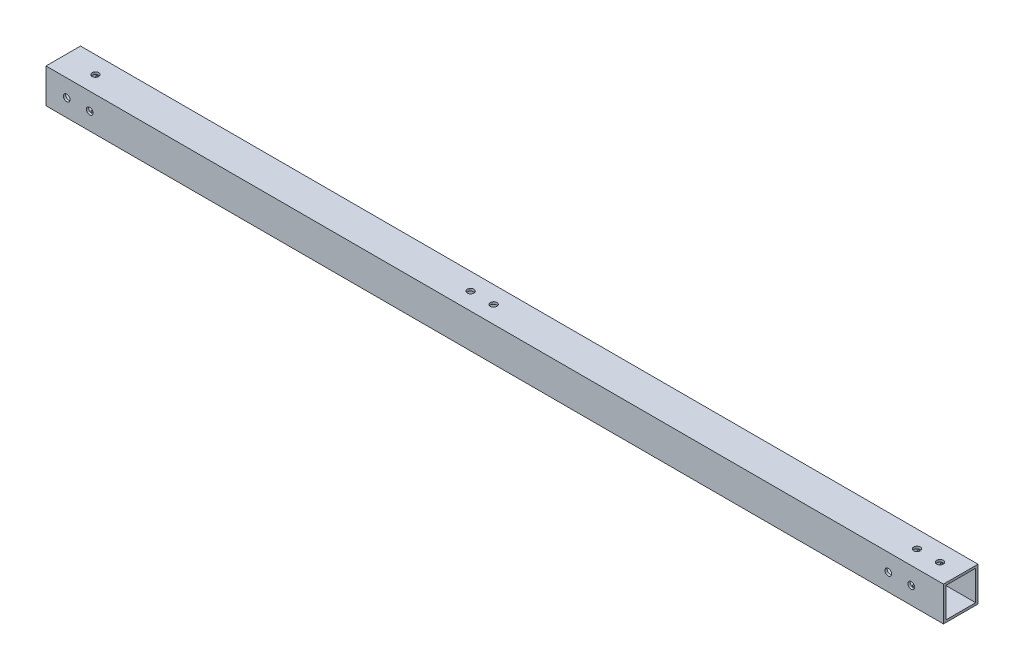
from build123d import *

# Parameters (mm, degrees)
SKETCH_1_W          = 15
SKETCH_1_H          = 15
SKETCH_1_W_2        = 13
SKETCH_1_H_2        = 13
EXTRUDE_1_DEPTH     = 390
SKETCH_2_R          = 1.45
CUT_EXTRUDE_1_DEPTH = 391.36041039
SKETCH_3_R          = 1.45
CUT_EXTRUDE_2_DEPTH = 391.36041039


with BuildPart() as part:
    # 草图1 → 凸台-拉伸1 (new body)
    with BuildSketch(Plane(origin=(0, 0, 0), x_dir=(0, 0, -1), z_dir=(1, 0, 0))):
        Rectangle(SKETCH_1_W, SKETCH_1_H)
        Rectangle(SKETCH_1_W_2, SKETCH_1_H_2, mode=Mode.SUBTRACT)
    extrude(amount=EXTRUDE_1_DEPTH)

    # 草图2 → 切除-拉伸1 (cut, through all)
    with BuildSketch(Plane(origin=(0, 0, -7.5), x_dir=(-1, 0, 0), z_dir=(0, 0, -1))):
        with Locations((-366, 0)):
            Circle(SKETCH_2_R)
        with Locations((-376, 0)):
            Circle(SKETCH_2_R)
        with Locations((-19, 0)):
            Circle(SKETCH_2_R)
        with Locations((-9, 0)):
            Circle(SKETCH_2_R)
    extrude(amount=-CUT_EXTRUDE_1_DEPTH, mode=Mode.SUBTRACT)

    # 草图3 → 切除-拉伸2 (cut, through all)
    with BuildSketch(Plane(origin=(0, 7.5, 0), x_dir=(1, 0, 0), z_dir=(0, 1, 0))):
        with Locations(Location((371, 0, 0), (0, 0, 270))):
            Circle(SKETCH_3_R)
        with Locations(Location((381, 0, 0), (0, 0, 270))):
            Circle(SKETCH_3_R)
        with Locations(Location((14, 0, 0), (0, 0, 270))):
            Circle(SKETCH_3_R)
        with Locations(Location((177, 0, 0), (0, 0, 270))):
            Circle(SKETCH_3_R)
        with Locations(Location((187, 0, 0), (0, 0, 270))):
            Circle(SKETCH_3_R)
    extrude(amount=-CUT_EXTRUDE_2_DEPTH, mode=Mode.SUBTRACT)


solid = part.part
